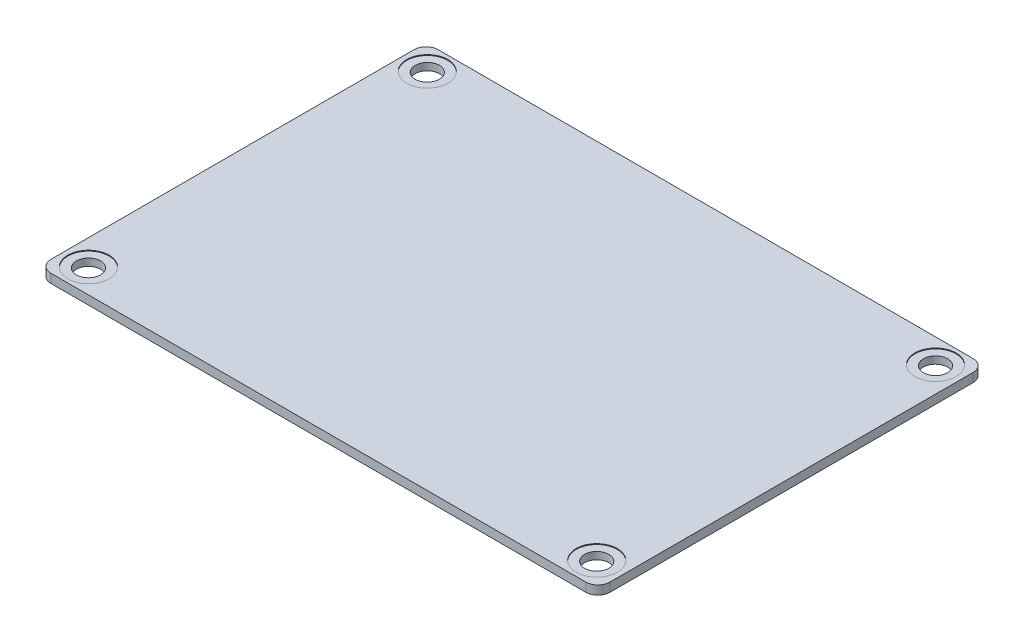
from build123d import *

# Parameters (mm, degrees)
SKETCH_1_R      = 2.55
EXTRUDE_1_DEPTH = 1.1
SKETCH_2_R      = 2.55
SKETCH_2_R_2    = 1.5
EXTRUDE_2_DEPTH = 0.9


with BuildPart() as part:
    # Эскиз1 → Бобышка-Вытянуть1 (new body)
    with BuildSketch(Plane(origin=(0, 0, 0), x_dir=(1, 0, 0), z_dir=(0, 1, 0))):
        with BuildLine():
            Line((33.15, -24), (-33.15, -24))
            ThreePointArc((-33.15, -24), (-34.210660172, -23.560660172), (-34.65, -22.5))
            Line((-34.65, -22.5), (-34.65, 22.5))
            ThreePointArc((-34.65, 22.5), (-34.210660172, 23.560660172), (-33.15, 24))
            Line((-33.15, 24), (33.15, 24))
            ThreePointArc((33.15, 24), (34.210660172, 23.560660172), (34.65, 22.5))
            Line((34.65, 22.5), (34.65, -22.5))
            ThreePointArc((34.65, -22.5), (34.210660172, -23.560660172), (33.15, -24))
        make_face()
        with Locations(Location((-31.5, 21, 0), (0, 0, 270))):
            Circle(SKETCH_1_R, mode=Mode.SUBTRACT)
        with Locations(Location((31.5, 21, 0), (0, 0, 270))):
            Circle(SKETCH_1_R, mode=Mode.SUBTRACT)
        with Locations(Location((31.5, -21, 0), (0, 0, 270))):
            Circle(SKETCH_1_R, mode=Mode.SUBTRACT)
        with Locations(Location((-31.5, -21, 0), (0, 0, 270))):
            Circle(SKETCH_1_R, mode=Mode.SUBTRACT)
    extrude(amount=EXTRUDE_1_DEPTH)

    # Эскиз2 → Бобышка-Вытянуть2 (add)
    # profile 1 of 4: a face of its own
    with BuildSketch(Plane(origin=(0, 0.1, 0), x_dir=(-1, 0, 0), z_dir=(0, -1, 0))):
        with Locations(Location((31.5, -21, 0), (0, 0, 90))):
            Circle(SKETCH_2_R)
        with Locations(Location((31.5, -21, 0), (0, 0, 90))):
            Circle(SKETCH_2_R_2, mode=Mode.SUBTRACT)
    # profile 2 of 4: a face of its own
    with BuildSketch(Plane(origin=(0, 0.1, 0), x_dir=(-1, 0, 0), z_dir=(0, -1, 0))):
        with Locations(Location((-31.5, -21, 0), (0, 0, 90))):
            Circle(SKETCH_2_R)
        with Locations(Location((-31.5, -21, 0), (0, 0, 90))):
            Circle(SKETCH_2_R_2, mode=Mode.SUBTRACT)
    # profile 3 of 4: a face of its own
    with BuildSketch(Plane(origin=(0, 0.1, 0), x_dir=(-1, 0, 0), z_dir=(0, -1, 0))):
        with Locations(Location((-31.5, 21, 0), (0, 0, 90))):
            Circle(SKETCH_2_R)
        with Locations(Location((-31.5, 21, 0), (0, 0, 90))):
            Circle(SKETCH_2_R_2, mode=Mode.SUBTRACT)
    # profile 4 of 4: a face of its own
    with BuildSketch(Plane(origin=(0, 0.1, 0), x_dir=(-1, 0, 0), z_dir=(0, -1, 0))):
        with Locations(Location((31.5, 21, 0), (0, 0, 90))):
            Circle(SKETCH_2_R)
        with Locations(Location((31.5, 21, 0), (0, 0, 90))):
            Circle(SKETCH_2_R_2, mode=Mode.SUBTRACT)
    extrude(amount=-EXTRUDE_2_DEPTH)


solid = part.part
